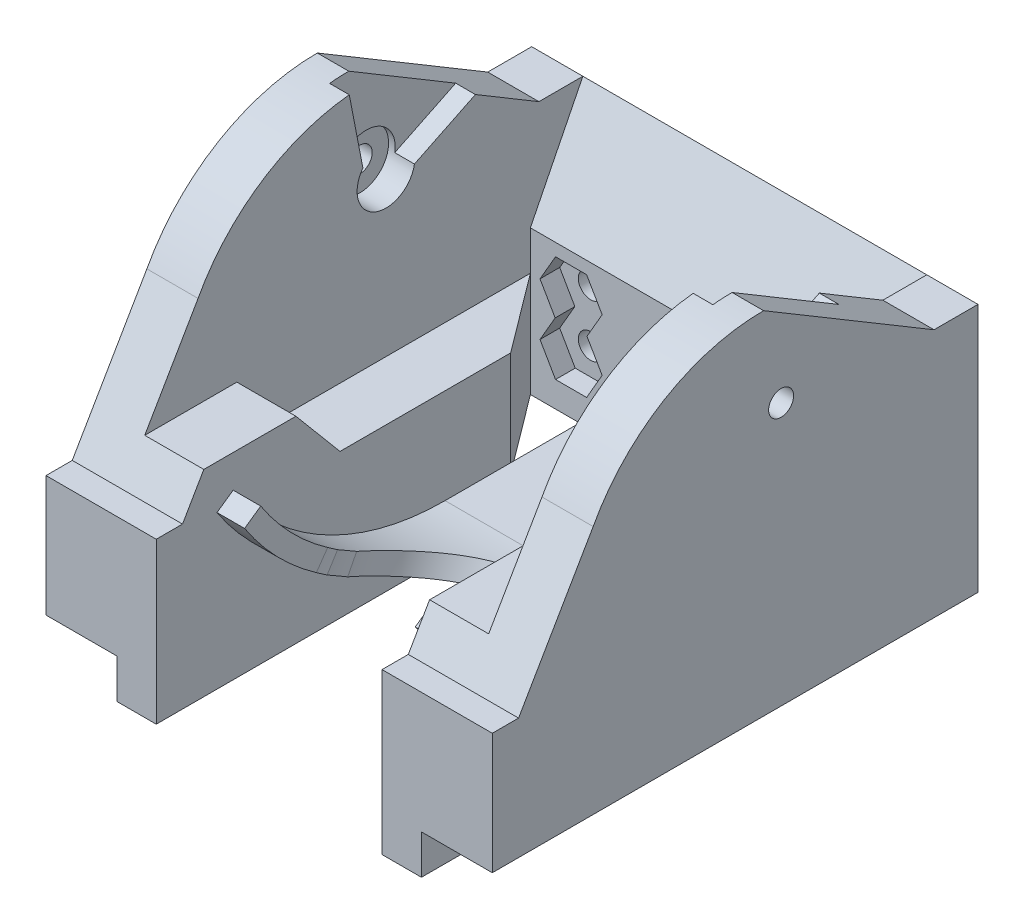
from build123d import *

# Parameters (mm, degrees)
CROQUIS1_W               = 34
CROQUIS1_H               = 19
SALIENTE_EXTRUIR1_DEPTH  = 35
CROQUIS2_W               = 26.2
CROQUIS2_H               = 31
CORTAR_EXTRUIR1_DEPTH    = 25
CORTAR_EXTRUIR3_DEPTH    = 26.2
SALIENTE_EXTRUIR2_DEPTH  = 34
CROQUIS10_W              = 26.2
CROQUIS10_H              = 25.966324345
CORTAR_EXTRUIR4_DEPTH    = 10
CROQUIS18_R              = 0.95
CORTAR_EXTRUIR11_DEPTH   = 4
CORTAR_EXTRUIR12_DEPTH   = 1.5
CORTAR_EXTRUIR14_START   = -34
CROQUIS21_R              = 0.95
CORTAR_EXTRUIR14_DEPTH   = 34
SALIENTE_EXTRUIR3_DEPTH  = 8
CROQUIS25_W              = 3
CROQUIS25_H              = 25
SALIENTE_EXTRUIR4_DEPTH  = 3
CROQUIS43_W              = 4.5
CROQUIS43_H              = 12
SALIENTE_EXTRUIR8_DEPTH  = 4
CORTAR_EXTRUIR20_START   = -1.5
CORTAR_EXTRUIR20_DEPTH   = 1.5
CORTAR_EXTRUIR21_DEPTH   = 27.7
CORTAR_EXTRUIR22_START   = -34
CORTAR_EXTRUIR22_DEPTH   = 34
CROQUIS36_R              = 2.2
CORTAR_EXTRUIR24_DEPTH   = 2
CORTAR_EXTRUIR25_START   = 28.2
CROQUIS36_2_R            = 2.2
CORTAR_EXTRUIR25_DEPTH   = 28.2
CORTAR_EXTRUIR26_START   = -34
CORTAR_EXTRUIR26_DEPTH   = 34
CORTAR_EXTRUIR28_START   = -23.2
CORTAR_EXTRUIR28_DEPTH   = 23.2
CORTAR_EXTRUIR29_DEPTH   = 26.2
SALIENTE_EXTRUIR9_DEPTH  = 17.2
CROQUIS49_R              = 6.5
CROQUIS50_R              = 6.5
CROQUIS53_W              = 17.2
CROQUIS53_H              = 1.49981493
SALIENTE_EXTRUIR13_DEPTH = 11
SALIENTE_EXTRUIR14_DEPTH = 17.2
SALIENTE_EXTRUIR15_DEPTH = 2


with BuildPart() as part:
    # Croquis1 → Saliente-Extruir1 (new body)
    with BuildSketch(Plane.XY):
        with Locations((-31.887263086, 5.12254902)):
            Rectangle(CROQUIS1_W, CROQUIS1_H)
    extrude(amount=SALIENTE_EXTRUIR1_DEPTH)

    # Croquis2 → Cortar-Extruir1 (cut)
    with BuildSketch(Plane.XZ.offset(4.37745098)):
        with Locations((-31.887263086, 19.5)):
            Rectangle(CROQUIS2_W, CROQUIS2_H)
    extrude(amount=-CORTAR_EXTRUIR1_DEPTH, mode=Mode.SUBTRACT)

    # Croquis4 → Cortar-Extruir3 (cut)
    with BuildSketch(Plane.ZY.offset(18.787263086)):
        Polygon((4, 14.62254902), (4, 6.62254902), (0, 14.62254902), align=None)
    extrude(amount=CORTAR_EXTRUIR3_DEPTH, mode=Mode.SUBTRACT)

    # Croquis9 → Saliente-Extruir2 (add)
    with BuildSketch(Plane(origin=(-14.887263086, 0, 0), x_dir=(0, 0, -1), z_dir=(1, 0, 0))):
        with BuildLine():
            Line((-29.315831827, 14.62254902), (-3.349507482, 14.62254902))
            ThreePointArc((-3.349507482, 14.62254902), (-16.332669655, 22.37254902), (-29.315831827, 14.62254902))
        make_face()
    extrude(amount=-SALIENTE_EXTRUIR2_DEPTH)

    # Croquis10 → Cortar-Extruir4 (cut)
    with BuildSketch(Plane.XZ.offset(-14.62254902)):
        with Locations((-31.887263086, 16.332669655)):
            Rectangle(CROQUIS10_W, CROQUIS10_H)
    extrude(amount=-CORTAR_EXTRUIR4_DEPTH, mode=Mode.SUBTRACT)

    # Croquis18 → Cortar-Extruir11 (cut)
    with BuildSketch(Plane(origin=(0, 0, 0), x_dir=(-1, 0, 0), z_dir=(0, 0, -1))):
        with Locations((41.887263086, -0.37745098)):
            Circle(CROQUIS18_R)
        with Locations((21.887263086, -0.37745098)):
            Circle(CROQUIS18_R)
        with Locations((21.887263086, 3.62254902)):
            Circle(CROQUIS18_R)
        with Locations((41.887263086, 3.62254902)):
            Circle(CROQUIS18_R)
    extrude(amount=-CORTAR_EXTRUIR11_DEPTH, mode=Mode.SUBTRACT)

    # Croquis19 → Cortar-Extruir12 (cut)
    with BuildSketch(Plane.XY.offset(4)):
        Polygon((-39.520126982, -0.37745098), (-40.67482752, 1.62254902), (-39.520126982, 3.62254902), (-40.703695034, 5.67254902), (-43.070831137, 5.67254902), (-44.254399189, 3.62254902), (-43.099698651, 1.62254902), (-44.254399189, -0.37745098), (-43.070831137, -2.42745098), (-40.703695034, -2.42745098), align=None)
        Polygon((-19.520126982, -0.37745098), (-20.67482752, 1.62254902), (-19.520126982, 3.62254902), (-20.703695034, 5.67254902), (-23.070831137, 5.67254902), (-24.254399189, 3.62254902), (-23.099698651, 1.62254902), (-24.254399189, -0.37745098), (-23.070831137, -2.42745098), (-20.703695034, -2.42745098), align=None)
    extrude(amount=-CORTAR_EXTRUIR12_DEPTH, mode=Mode.SUBTRACT)

    # Croquis21 → Cortar-Extruir14 (cut)
    with BuildSketch(Plane(origin=(-14.887263086, 0, 0), x_dir=(0, 0, -1), z_dir=(1, 0, 0)).offset(CORTAR_EXTRUIR14_START)):
        with Locations((-15, 15.62254902)):
            Circle(CROQUIS21_R)
    extrude(amount=CORTAR_EXTRUIR14_DEPTH, mode=Mode.SUBTRACT)

    # Croquis23 → Saliente-Extruir3 (add)
    with BuildSketch(Plane.XZ.offset(4.37745098)):
        Polygon((-44.987263086, 35), (-40.487263086, 35), (-40.487263086, 10), (-44.987263086, 4), align=None)
        Polygon((-18.787263086, 35), (-23.287263086, 35), (-23.287263086, 10), (-18.787263086, 4), align=None)
    extrude(amount=-SALIENTE_EXTRUIR3_DEPTH)

    # Croquis25 → Saliente-Extruir4 (add)
    with BuildSketch(Plane.XZ.offset(4.37745098)):
        with Locations((-41.987263086, 22.5)):
            Rectangle(CROQUIS25_W, CROQUIS25_H)
        with Locations((-21.787263086, 22.5)):
            Rectangle(CROQUIS25_W, CROQUIS25_H)
    extrude(amount=SALIENTE_EXTRUIR4_DEPTH)

    # Croquis43 → Saliente-Extruir8 (add)
    with BuildSketch(Plane(origin=(0, 3.62254902, 0), x_dir=(1, 0, 0), z_dir=(0, 1, 0))):
        with Locations((-21.037263086, -29)):
            Rectangle(CROQUIS43_W, CROQUIS43_H)
        with Locations((-42.737263086, -29)):
            Rectangle(CROQUIS43_W, CROQUIS43_H)
    extrude(amount=SALIENTE_EXTRUIR8_DEPTH)

    # Croquis29 → Cortar-Extruir20 (cut)
    with BuildSketch(Plane.ZY.offset(18.787263086).offset(CORTAR_EXTRUIR20_START)):
        with BuildLine():
            Line((17.797402962, 22.299641931), (16.5, 15.62254902))
            ThreePointArc((16.5, 15.62254902), (15.426958984, 14.184596995), (13.743058632, 14.803953638))
            Line((13.743058632, 14.803953638), (6.296886003, 18.432060872))
            ThreePointArc((6.296886003, 18.432060872), (11.631045274, 21.603150873), (17.797402962, 22.299641931))
        make_face()
    extrude(amount=CORTAR_EXTRUIR20_DEPTH, mode=Mode.SUBTRACT)

    # Croquis29<2> → Cortar-Extruir21 (cut)
    with BuildSketch(Plane.ZY.offset(18.787263086)):
        with BuildLine():
            Line((17.797402962, 22.299641931), (16.5, 15.62254902))
            ThreePointArc((16.5, 15.62254902), (15.426958984, 14.184596995), (13.743058632, 14.803953638))
            Line((13.743058632, 14.803953638), (6.296886003, 18.432060872))
            ThreePointArc((6.296886003, 18.432060872), (11.631045274, 21.603150873), (17.797402962, 22.299641931))
        make_face()
    extrude(amount=CORTAR_EXTRUIR21_DEPTH, mode=Mode.SUBTRACT)

    # Croquis30 → Cortar-Extruir22 (cut)
    with BuildSketch(Plane.ZY.offset(48.887263086).offset(CORTAR_EXTRUIR22_START)):
        Polygon((29.315831827, 14.62254902), (35, 4.827802707), (35, 14.62254902), align=None)
    extrude(amount=CORTAR_EXTRUIR22_DEPTH, mode=Mode.SUBTRACT)

    # Croquis36 → Cortar-Extruir24 (cut)
    with BuildSketch(Plane.ZY.offset(18.787263086)):
        with Locations((15, 15.62254902)):
            Circle(CROQUIS36_R)
    extrude(amount=-CORTAR_EXTRUIR24_DEPTH, mode=Mode.SUBTRACT)

    # Croquis36<2> → Cortar-Extruir25 (cut)
    with BuildSketch(Plane.ZY.offset(18.787263086).offset(CORTAR_EXTRUIR25_START)):
        with Locations((15, 15.62254902)):
            Circle(CROQUIS36_2_R)
    extrude(amount=-CORTAR_EXTRUIR25_DEPTH, mode=Mode.SUBTRACT)

    # Croquis38 → Cortar-Extruir26 (cut)
    with BuildSketch(Plane.ZY.offset(48.887263086).offset(CORTAR_EXTRUIR26_START)):
        Polygon((3.349507482, 14.62254902), (16.332669655, 22.37254902), (3.349507482, 22.37254902), align=None)
    extrude(amount=CORTAR_EXTRUIR26_DEPTH, mode=Mode.SUBTRACT)

    # Croquis41 → Cortar-Extruir28 (cut)
    with BuildSketch(Plane(origin=(-20.287263086, 0, 0), x_dir=(0, 0, -1), z_dir=(1, 0, 0)).offset(CORTAR_EXTRUIR28_START)):
        Polygon((-10, -4.37745098), (-10, -7.37745098), (-13, -7.37745098), align=None)
    extrude(amount=CORTAR_EXTRUIR28_DEPTH, mode=Mode.SUBTRACT)

    # Croquis44 → Cortar-Extruir29 (cut)
    with BuildSketch(Plane.ZY.offset(18.787263086)):
        Polygon((23, 7.62254902), (26.362551066, 7.62254902), (23, 3.62254902), align=None)
    extrude(amount=CORTAR_EXTRUIR29_DEPTH, mode=Mode.SUBTRACT)



with BuildPart() as body_2:
    # Croquis45 → Saliente-Extruir9 (new body)
    with BuildSketch(Plane.ZY.offset(23.287263086)):
        with BuildLine():
            Line((32.372332418, 4.275439874), (31.142668885, 5.135569413))
            ThreePointArc((31.142668885, 5.135569413), (24.183902835, -1.295442254), (15, -3.62745098))
            Line((15, -3.62745098), (15, -5.12726591))
            ThreePointArc((15, -5.12726591), (24.876851848, -2.625810281), (32.372332418, 4.275439874))
        make_face()
    extrude(amount=SALIENTE_EXTRUIR9_DEPTH)

    # Cortar-Barrer2: sweep along a path in Croquis47
    with BuildLine(Plane(origin=(-31.887263086, 4.275439874, 32.372332418), x_dir=(0, 0, -1), z_dir=(1, 0, 0))) as cortar_barrer2_path:
        Line((17.372332418, 11.347109145), (-5.570725036, -21.418972626))
    # Croquis48 → Cortar-Barrer2 (sweep, cut)
    with BuildSketch(Plane(origin=(-31.887263086, -17.143532752, 37.943057454), x_dir=(-1, 0, 0), z_dir=(0, -0.8191520442889911, 0.5735764363510472))):
        with BuildLine():
            Line((6.5, 0), (6.5, -15))
            Line((6.5, -15), (-6.5, -15))
            Line((-6.5, -15), (-6.5, 0))
            ThreePointArc((-6.5, 0), (0, 6.5), (6.5, 0))
        make_face()
    sweep(path=cortar_barrer2_path.line, mode=Mode.SUBTRACT)

    # Cortar-Barrer3: sweep along a path in Croquis51
    with BuildLine(Plane(origin=(-31.887263086, 4.275439874, 32.372332418), x_dir=(0, 0, -1), z_dir=(1, 0, 0))) as cortar_barrer3_path:
        Line((17.372332418, 11.347109145), (-2.627667582, -23.293907006))
    # Croquis49 → Cortar-Barrer3 (sweep, cut)
    with BuildSketch(Plane(origin=(-31.887263086, -19.018467132, 35), x_dir=(-1, 0, 0), z_dir=(0, -0.8660254037844382, 0.5000000000000011))):
        Circle(CROQUIS49_R)
    sweep(path=cortar_barrer3_path.line, mode=Mode.SUBTRACT)

    # Cortar-Barrer4: sweep along a path in Croquis52
    with BuildLine(Plane(origin=(-31.887263086, 4.275439874, 32.372332418), x_dir=(0, 0, -1), z_dir=(1, 0, 0))) as cortar_barrer4_path:
        Line((17.372332418, 11.347109145), (0.467601948, -24.905202336))
    # Croquis50 → Cortar-Barrer4 (sweep, cut)
    with BuildSketch(Plane(origin=(-31.887263086, -20.629762462, 31.90473047), x_dir=(-1, 0, 0), z_dir=(0, -0.9063077870366495, 0.4226182617407004))):
        Circle(CROQUIS50_R)
    sweep(path=cortar_barrer4_path.line, mode=Mode.SUBTRACT)


with BuildPart() as body_3:
    # Croquis53 → Saliente-Extruir13 (new body)
    with BuildSketch(Plane(origin=(0, 0, 15), x_dir=(-1, 0, 0), z_dir=(0, 0, -1))):
        with Locations((31.887263086, -4.377358445)):
            Rectangle(CROQUIS53_W, CROQUIS53_H)
    extrude(amount=SALIENTE_EXTRUIR13_DEPTH)


with BuildPart() as part_1:
    add(part.part)

    add(body_3.part)  # Saliente-Extruir14 merges body 3
    # Croquis55 → Saliente-Extruir14 (add)
    with BuildSketch(Plane.ZY.offset(40.487263086)):
        Polygon((4, -5.12726591), (4, -4.377358445), (0, -4.377358445), align=None)
    extrude(amount=-SALIENTE_EXTRUIR14_DEPTH)

    # Croquis56 → Saliente-Extruir15 (add)
    with BuildSketch(Plane.XY.offset(35)):
        Polygon((-23.287263086, -7.37745098), (-20.287263086, -7.37745098), (-20.287263086, -4.37745098), (-14.887263086, -4.37745098), (-14.887263086, 4.827802707), (-23.287263086, 4.827802707), align=None)
        Polygon((-40.487263086, -7.37745098), (-40.487263086, 4.827802707), (-48.887263086, 4.827802707), (-48.887263086, -4.37745098), (-43.487263086, -4.37745098), (-43.487263086, -7.37745098), align=None)
    extrude(amount=SALIENTE_EXTRUIR15_DEPTH)


solid = Compound([body_2.part, part_1.part])
